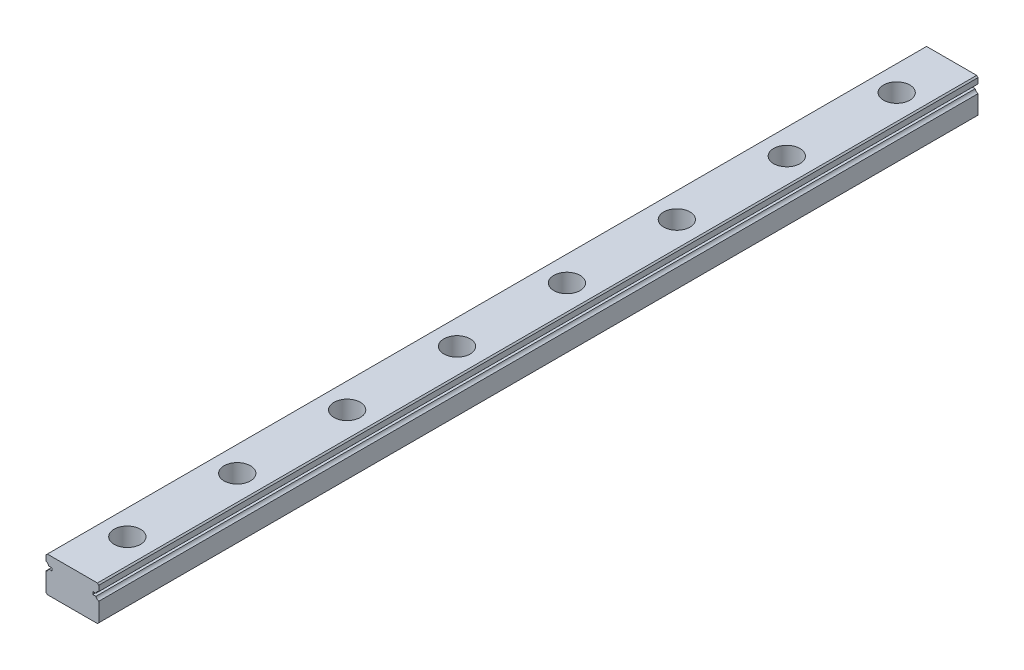
from build123d import *

# Parameters (mm, degrees)
EXTRUDE_1_DEPTH        = 200
SKETCH_2_R             = 3
SKETCH_2_R_2           = 1.75
CUT_EXTRUDE_1_DEPTH    = 4.5
SKETCH_2_2_R           = 1.75
CUT_EXTRUDE_2_DEPTH    = 201.249843945
PATTERN_LINEAR_1_COUNT = 10
PATTERN_LINEAR_1_PITCH = 25


with BuildPart() as part:
    # Эскиз1 → Бобышка-Вытянуть1 (new body)
    with BuildSketch(Plane.XY):
        with BuildLine():
            Line((-6, 3.7), (-5.7, 4))
            Line((-5.7, 4), (5.7, 4))
            Line((5.7, 4), (6, 3.7))
            Line((6, 3.7), (6, 2.451013544))
            ThreePointArc((6, 2.451013544), (5.597935912, 2.202976267), (5.354599002, 1.798050138))
            Line((5.354599002, 1.798050138), (4.643514056, 1.798050138))
            Line((4.643514056, 1.798050138), (4.643514056, 1.201949862))
            Line((4.643514056, 1.201949862), (5.354599002, 1.201949862))
            ThreePointArc((5.354599002, 1.201949862), (5.597935912, 0.797023733), (6, 0.548986456))
            Line((6, 0.548986456), (6, -3.7))
            Line((6, -3.7), (5.7, -4))
            Line((5.7, -4), (-5.7, -4))
            Line((-5.7, -4), (-6, -3.7))
            Line((-6, -3.7), (-6, 0.548986456))
            ThreePointArc((-6, 0.548986456), (-5.597935912, 0.797023733), (-5.354599002, 1.201949862))
            Line((-5.354599002, 1.201949862), (-4.643514056, 1.201949862))
            Line((-4.643514056, 1.201949862), (-4.643514056, 1.798050138))
            Line((-4.643514056, 1.798050138), (-5.354599002, 1.798050138))
            ThreePointArc((-5.354599002, 1.798050138), (-5.597935912, 2.202976267), (-6, 2.451013544))
            Line((-6, 2.451013544), (-6, 3.7))
        make_face()
    extrude(amount=EXTRUDE_1_DEPTH)

    # Эскиз2 → Вырез-Вытянуть1 (cut)
    with BuildSketch(Plane(origin=(0, 4, 0), x_dir=(1, 0, 0), z_dir=(0, 1, 0))):
        with Locations((0, -12.5)):
            Circle(SKETCH_2_R)
        with Locations((0, -12.5)):
            Circle(SKETCH_2_R_2, mode=Mode.SUBTRACT)
    cut_extrude_1 = extrude(amount=-CUT_EXTRUDE_1_DEPTH, mode=Mode.SUBTRACT)

    # Эскиз2<2> → Вырез-Вытянуть2 (cut, through all)
    with BuildSketch(Plane(origin=(0, 4, 0), x_dir=(1, 0, 0), z_dir=(0, 1, 0))):
        with Locations((0, -12.5)):
            Circle(SKETCH_2_2_R)
    cut_extrude_2 = extrude(amount=-CUT_EXTRUDE_2_DEPTH, mode=Mode.SUBTRACT)

    # Линейный массив1: Вырез-Вытянуть1, Вырез-Вытянуть2 ×10
    with Locations(*[(0, 0, i * PATTERN_LINEAR_1_PITCH) for i in range(1, PATTERN_LINEAR_1_COUNT)]):
        add(cut_extrude_1, mode=Mode.SUBTRACT)
        add(cut_extrude_2, mode=Mode.SUBTRACT)


solid = part.part
